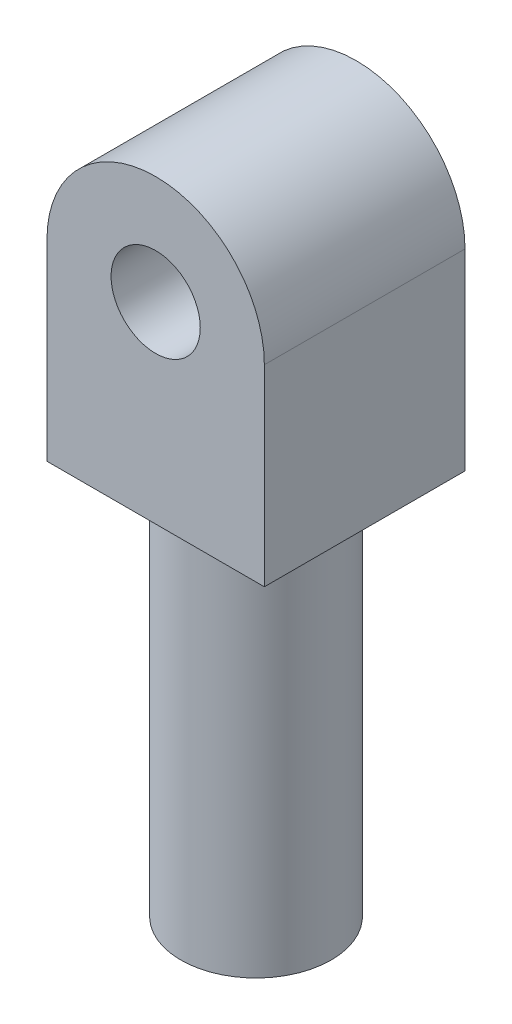
from build123d import *

# Parameters (mm, degrees)
SKETCH1_R           = 4
BOSS_EXTRUDE2_DEPTH = 18
SKETCH2_R           = 6.75
BOSS_EXTRUDE3_DEPTH = 35


with BuildPart() as part:
    # Sketch1 → Boss-Extrude2 (new body)
    with BuildSketch(Plane.XY):
        with BuildLine():
            Line((-9.75, 0), (-9.75, -17.25))
            Line((-9.75, -17.25), (9.75, -17.25))
            Line((9.75, -17.25), (9.75, 0))
            ThreePointArc((9.75, 0), (0, 9.75), (-9.75, 0))
        make_face()
        Circle(SKETCH1_R, mode=Mode.SUBTRACT)
    extrude(amount=BOSS_EXTRUDE2_DEPTH)

    # Sketch2 → Boss-Extrude3 (add)
    with BuildSketch(Plane.XZ.offset(17.25)):
        with Locations((0, 9)):
            Circle(SKETCH2_R)
    extrude(amount=BOSS_EXTRUDE3_DEPTH)


solid = part.part
